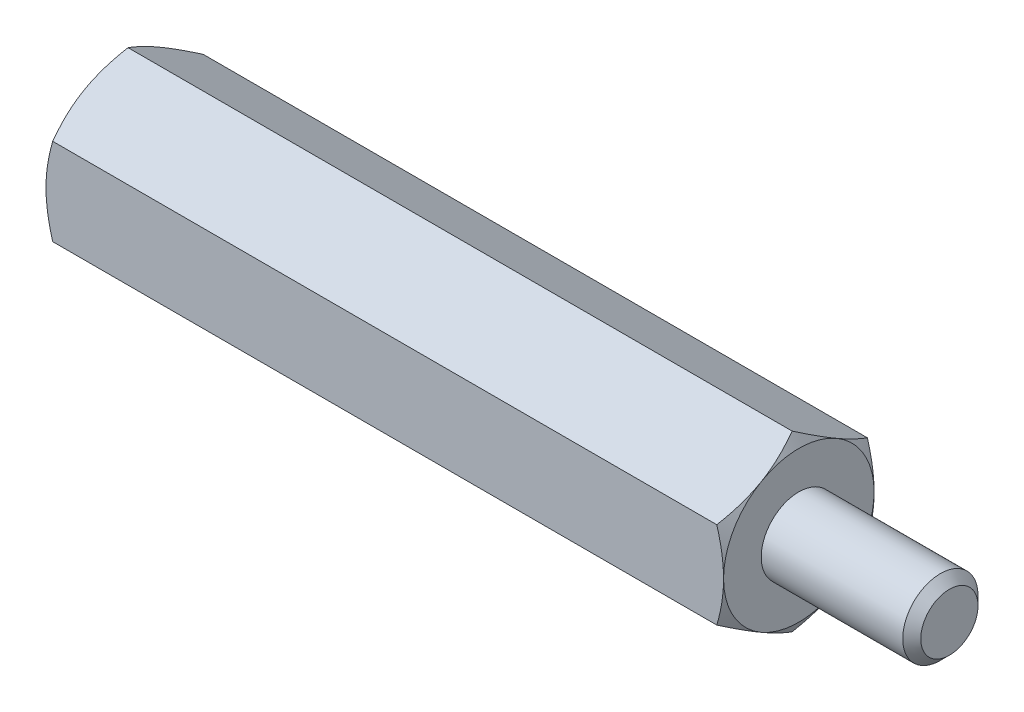
from build123d import *

# Parameters (mm, degrees)
SKETCH2_R         = 2.5
EXTRUDE1_DEPTH    = 10
CHAMFER1_SIZE     = 0.6
EXTRUDE4_DEPTH    = 45
SKETCH8_OUTSIDE_W = 219.234
SKETCH8_OUTSIDE_H = 220.782
SKETCH8_OUTSIDE_R = 5
EXTRUDE5_DEPTH    = 56.52777083
EXTRUDE5_DRAFT    = -60
SKETCH9_OUTSIDE_W = 184.994
SKETCH9_OUTSIDE_H = 186.542
SKETCH9_OUTSIDE_R = 5
EXTRUDE6_DEPTH    = 46.643546459
EXTRUDE6_DRAFT    = -60
EXTRUDE7_START    = -12.7
SKETCH10_R        = 2.5
EXTRUDE7_DEPTH    = 12.7
SKETCH13_R        = 2.5508
EXTRUDE8_DEPTH    = 56.52777083


with BuildPart() as part:
    # Sketch2 → Extrude1 (new body)
    with BuildSketch(Plane(origin=(27.5, 0, 0), x_dir=(0, 0, -1), z_dir=(1, 0, 0))):
        Circle(SKETCH2_R)
    extrude(amount=-EXTRUDE1_DEPTH)

    # Chamfer1
    chamfer1_edges = [part.edges().sort_by_distance(p)[0] for p in [
        (27.5, 0, 2.5),
    ]]
    chamfer(chamfer1_edges, length=CHAMFER1_SIZE)

    # Sketch7 → Extrude4 (add)
    with BuildSketch(Plane(origin=(17.5, 0, 0), x_dir=(0, 0, -1), z_dir=(1, 0, 0))):
        Polygon((0, 5.773502692), (-5, 2.886751346), (-5, -2.886751346), (0, -5.773502692), (5, -2.886751346), (5, 2.886751346), align=None)
    extrude(amount=-EXTRUDE4_DEPTH)


with BuildPart() as extrude5_tool:
    # Sketch8 outside → Extrude5 (with draft: the straight prism first)
    with BuildSketch(Plane.ZY.offset(27.5)):
        Rectangle(SKETCH8_OUTSIDE_W, SKETCH8_OUTSIDE_H)
        Circle(SKETCH8_OUTSIDE_R, mode=Mode.SUBTRACT)
    extrude(amount=-EXTRUDE5_DEPTH)
    # Extrude5: the draft: its side faces are tilted about the plane it starts from
    extrude5_sides = [extrude5_tool.faces().sort_by_distance(p)[0] for p in [
        (0.763885415, -110.391, 0),
        (0.763885415, 0, 109.617),
        (0.763885415, 110.391, 0),
        (0.763885415, 0, -109.617),
        (0.763885415, 0, -5),
    ]]
    draft(extrude5_sides, Plane.ZY.offset(27.5), EXTRUDE5_DRAFT)


with BuildPart() as part_1:
    add(part.part)

    # Extrude5: cut by extrude5_tool
    add(extrude5_tool.part, mode=Mode.SUBTRACT)


with BuildPart() as extrude6_tool:
    # Sketch9 outside → Extrude6 (with draft: the straight prism first)
    with BuildSketch(Plane(origin=(17.5, 0, 0), x_dir=(0, 0, -1), z_dir=(1, 0, 0))):
        Rectangle(SKETCH9_OUTSIDE_W, SKETCH9_OUTSIDE_H)
        Circle(SKETCH9_OUTSIDE_R, mode=Mode.SUBTRACT)
    extrude(amount=-EXTRUDE6_DEPTH)
    # Extrude6: the draft: its side faces are tilted about the plane it starts from
    extrude6_sides = [extrude6_tool.faces().sort_by_distance(p)[0] for p in [
        (-5.821773229, -93.271, 0),
        (-5.821773229, 0, -92.497),
        (-5.821773229, 93.271, 0),
        (-5.821773229, 0, 92.497),
        (-5.821773229, 0, 5),
    ]]
    draft(extrude6_sides, Plane(origin=(17.5, 0, 0), x_dir=(0, 0, -1), z_dir=(1, 0, 0)), EXTRUDE6_DRAFT)


with BuildPart() as part_2:
    add(part_1.part)

    # Extrude6: cut by extrude6_tool
    add(extrude6_tool.part, mode=Mode.SUBTRACT)

    # Sketch10 → Extrude7 (cut)
    with BuildSketch(Plane.ZY.offset(27.5).offset(EXTRUDE7_START)):
        with Locations(Location((0, 0, 0), (0, 0, 180))):
            Circle(SKETCH10_R)
    extrude(amount=EXTRUDE7_DEPTH, mode=Mode.SUBTRACT)

    # Sketch13 → Extrude8 (cut)
    with BuildSketch(Plane.ZY.offset(27.5)):
        Circle(SKETCH13_R)
    extrude(amount=EXTRUDE8_DEPTH, mode=Mode.SUBTRACT)

    # Extrude8 cone 1 section (through the dimple's axis) → Extrude8 other way (revolve, cut)
    with BuildSketch(Plane(origin=(-27.5, 0, 0), x_dir=(0, 0, 1), z_dir=(0, 1, 0))):
        Polygon((0, 0), (2.5508, 0), (0, 2.5508), align=None)
    revolve(axis=Axis((-27.5, 0, 0), (1, 0, 0)), mode=Mode.SUBTRACT)


solid = part_2.part
